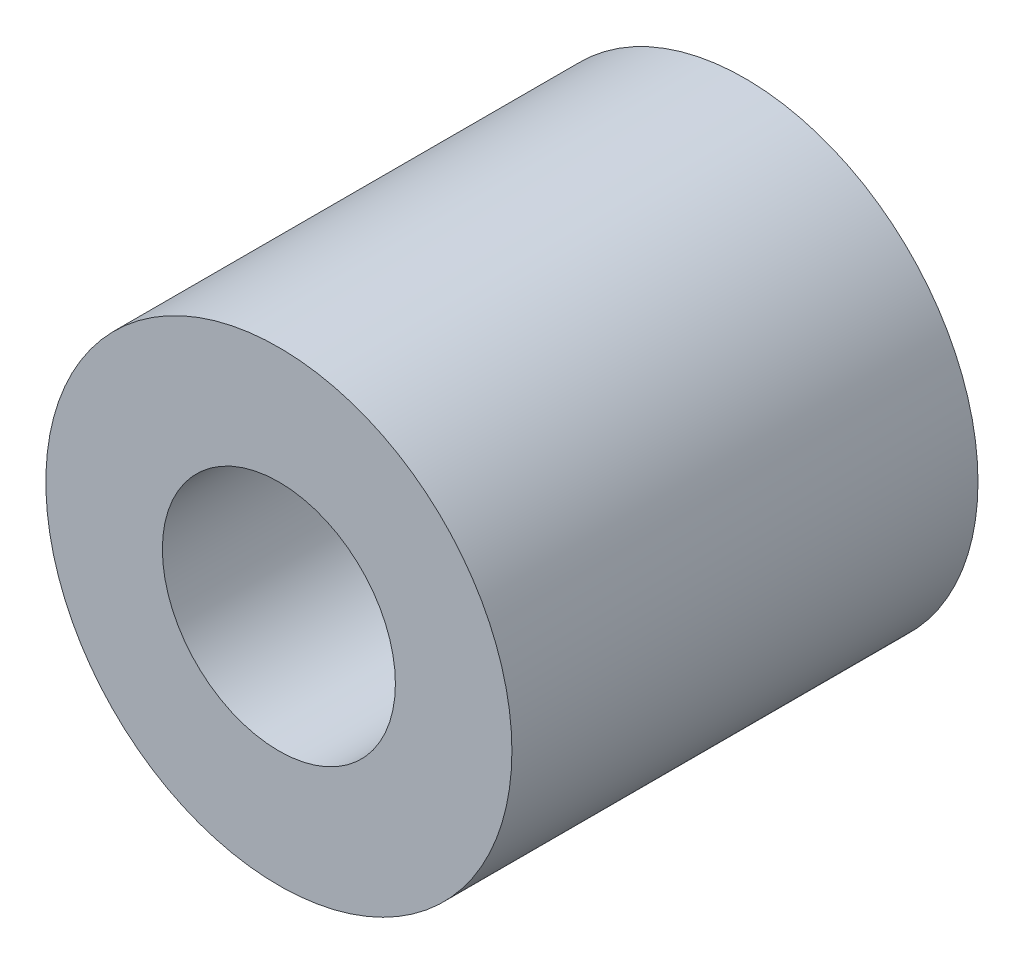
from build123d import *

# Parameters (mm, degrees)
SKETCH1_R           = 2.5
SKETCH1_R_2         = 1.25
BOSS_EXTRUDE1_DEPTH = 5


with BuildPart() as part:
    # Sketch1 → Boss-Extrude1 (new body)
    with BuildSketch(Plane.XY):
        Circle(SKETCH1_R)
        Circle(SKETCH1_R_2, mode=Mode.SUBTRACT)
    extrude(amount=BOSS_EXTRUDE1_DEPTH)


solid = part.part
